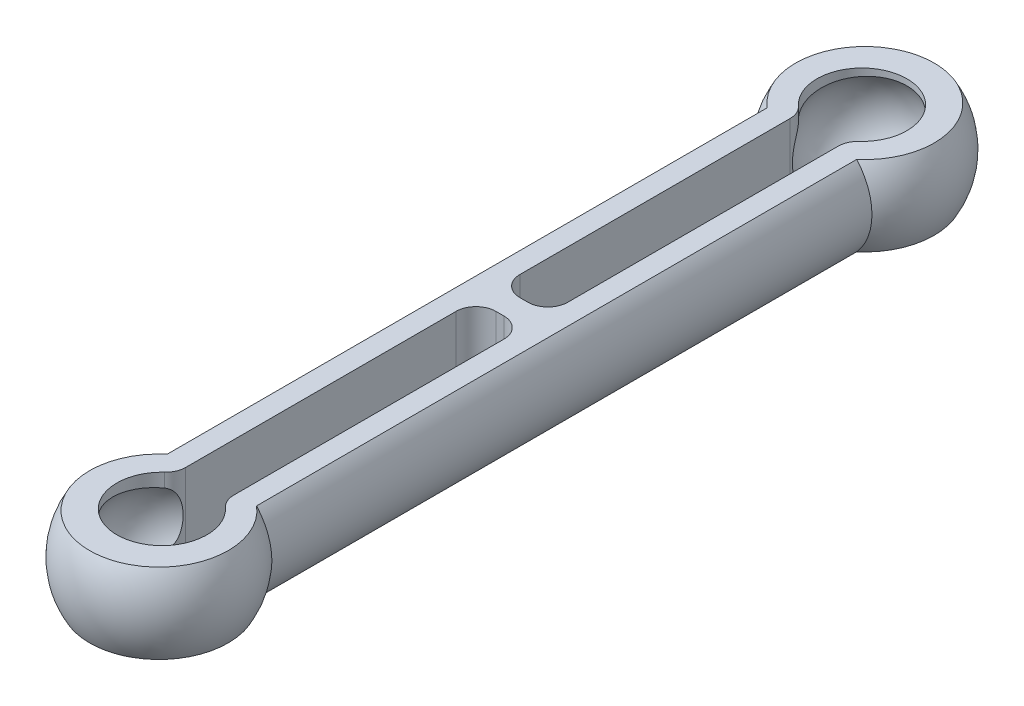
from build123d import *

# Parameters (mm, degrees)
CUT_EXTRUDE1_DEPTH = 30
CUT_EXTRUDE2_DEPTH = 30


with BuildPart() as part:
    # Sketch1 → Revolve1 (revolve)
    with BuildSketch(Plane(origin=(0, 0, 0), x_dir=(1, 0, 0), z_dir=(0, 1, 0))):
        with BuildLine():
            Line((-3, -15), (-3, 15))
            ThreePointArc((-3, 15), (-3.645751311, 19.291502622), (0, 21.645751311))
            Line((0, 21.645751311), (0, 20.345751311))
            ThreePointArc((0, 20.345751311), (-2.7, 17.645751311), (0, 14.945751311))
            Line((0, 14.945751311), (0, 13.645751311))
            Line((0, 13.645751311), (0, -13.645751311))
            Line((0, -13.645751311), (0, -14.945751311))
            ThreePointArc((0, -14.945751311), (-2.7, -17.645751311), (0, -20.345751311))
            Line((0, -20.345751311), (0, -21.645751311))
            ThreePointArc((0, -21.645751311), (-3.645751311, -19.291502622), (-3, -15))
        make_face()
    revolve(axis=Axis((0, 0, -91.394122854), (0, 0, 1)))

    # Sketch2 → Cut-Extrude1 (cut, symmetric)
    with BuildSketch(Plane(origin=(0, 0, 0), x_dir=(1, 0, 0), z_dir=(0, 1, 0))):
        with BuildLine():
            Line((-1.2, 15.107825257), (-1.2, 1.596713369))
            ThreePointArc((-1.2, 1.596713369), (-0.907106781, 0.889606588), (-0.2, 0.596713369))
            Line((-0.2, 0.596713369), (0.2, 0.596713369))
            ThreePointArc((0.2, 0.596713369), (0.907106781, 0.889606588), (1.2, 1.596713369))
            Line((1.2, 1.596713369), (1.2, 15.107825257))
            ThreePointArc((1.2, 15.107825257), (1.284324545, 15.509743733), (1.523076923, 15.843879024))
            ThreePointArc((1.523076923, 15.843879024), (0, 19.75), (-1.523076923, 15.843879024))
            ThreePointArc((-1.523076923, 15.843879024), (-1.284324545, 15.509743733), (-1.2, 15.107825257))
        make_face()
        with BuildLine():
            Line((-1.2, -15.107825257), (-1.2, -1.596713369))
            ThreePointArc((-1.2, -1.596713369), (-0.907106781, -0.889606588), (-0.2, -0.596713369))
            Line((-0.2, -0.596713369), (0.2, -0.596713369))
            ThreePointArc((0.2, -0.596713369), (0.907106781, -0.889606588), (1.2, -1.596713369))
            Line((1.2, -1.596713369), (1.2, -15.107825257))
            ThreePointArc((1.2, -15.107825257), (1.284324545, -15.509743733), (1.523076923, -15.843879024))
            ThreePointArc((1.523076923, -15.843879024), (0, -19.75), (-1.523076923, -15.843879024))
            ThreePointArc((-1.523076923, -15.843879024), (-1.284324545, -15.509743733), (-1.2, -15.107825257))
        make_face()
    extrude(amount=CUT_EXTRUDE1_DEPTH, both=True, mode=Mode.SUBTRACT)

    # Sketch3 → Cut-Extrude2 (cut, symmetric)
    with BuildSketch(Plane(origin=(0, 0, 0), x_dir=(0, 0, -1), z_dir=(1, 0, 0))):
        Polygon((0, -2), (70.025003907, -2), (70.025003907, -4), (-79.974996093, -4), (-79.974996093, -2), align=None)
        Polygon((0, 2), (70.025003907, 2), (70.025003907, 4), (-79.974996093, 4), (-79.974996093, 2), align=None)
    extrude(amount=CUT_EXTRUDE2_DEPTH, both=True, mode=Mode.SUBTRACT)


solid = part.part
